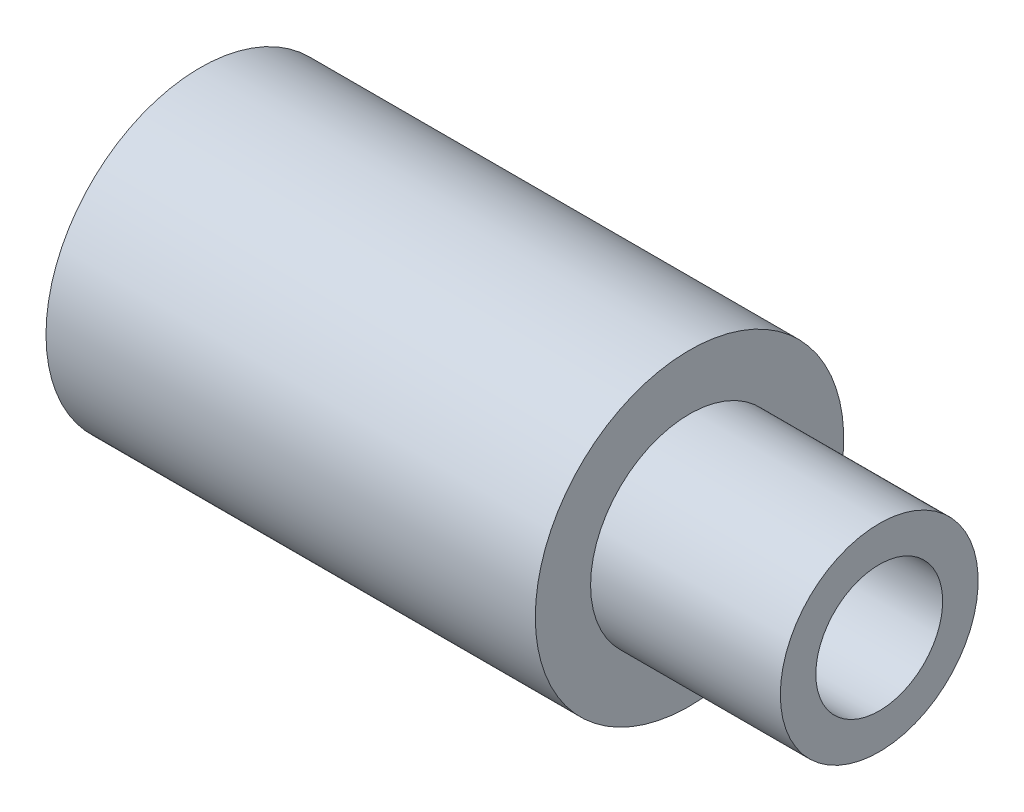
from build123d import *

# Parameters (mm, degrees)
SOCKET_SKETCH_W = 36
SOCKET_SKETCH_H = 3.175


with BuildPart() as part:
    # Conn_T4_ORB4_Bored Sketch → Conn_T4_ORB4_Bored (revolve)
    with BuildSketch(Plane.XY):
        Polygon((9.5, 0), (9.5, 4.953), (0, 4.953), (0, 7.722), (-24.5, 7.722), (-24.5, 0), align=None)
    revolve(axis=Axis((-1000, 0, 0), (1, 0, 0)))

    # Socket Sketch → Socket (revolve, cut)
    with BuildSketch(Plane.XY):
        with Locations((-7.5, 1.5875)):
            Rectangle(SOCKET_SKETCH_W, SOCKET_SKETCH_H)
    revolve(axis=Axis((-1000, 0, 0), (1, 0, 0)), mode=Mode.SUBTRACT)


solid = part.part
